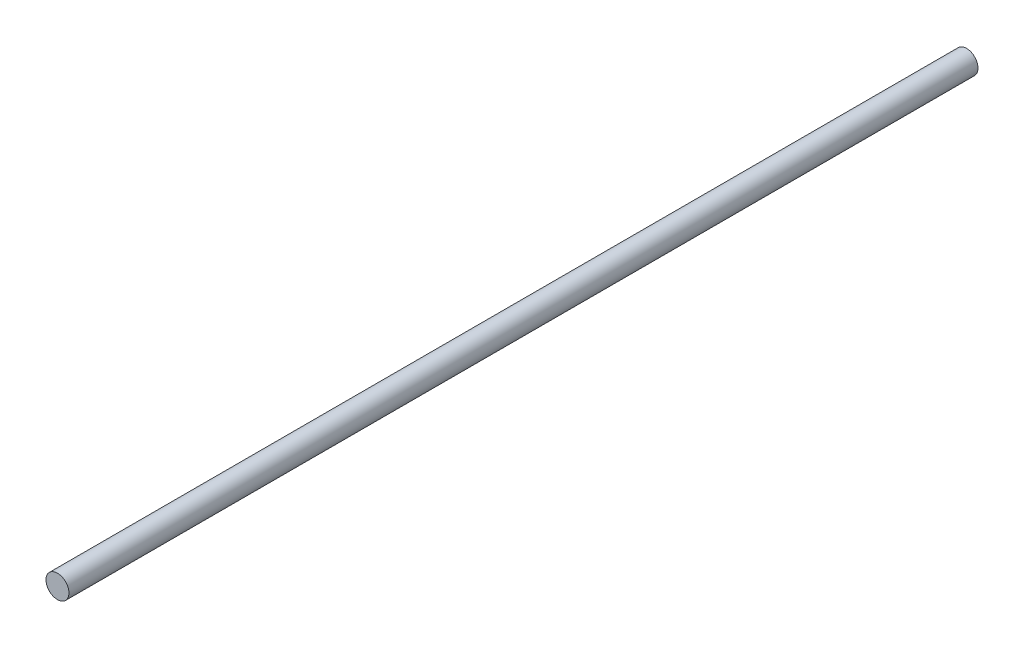
from build123d import *

# Parameters (mm, degrees)
SKETCH1_R           = 3.175
BOSS_EXTRUDE1_DEPTH = 251.46


with BuildPart() as part:
    # Sketch1 → Boss-Extrude1 (new body)
    with BuildSketch(Plane.XY):
        Circle(SKETCH1_R)
    extrude(amount=-BOSS_EXTRUDE1_DEPTH)


solid = part.part
